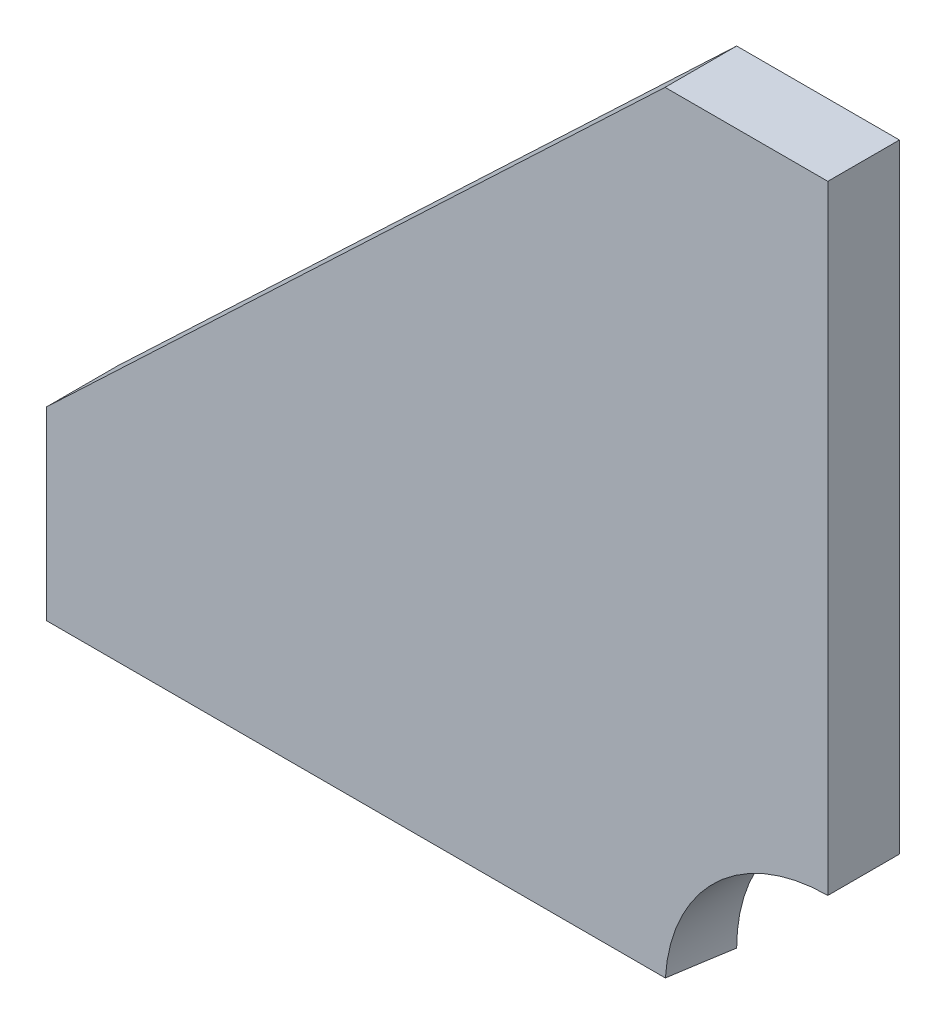
from build123d import *

# Parameters (mm, degrees)
BOSS_EXTRUDE1_DEPTH = 11
CUT_EXTRUDE1_DEPTH  = 116


with BuildPart() as part:
    # Sketch1 → Boss-Extrude1 (new body)
    with BuildSketch(Plane.XY):
        with BuildLine():
            Line((25, 0), (0, 0))
            Line((0, 0), (-95, -90))
            Line((-95, -90), (-95, -120))
            Line((-95, -120), (0, -120))
            ThreePointArc((0, -120), (7.32233047, -102.32233047), (25, -95))
            Line((25, -95), (25, 0))
        make_face()
    extrude(amount=BOSS_EXTRUDE1_DEPTH)

    # Sketch2 → Cut-Extrude1 (cut)
    with BuildSketch(Plane.ZY.offset(95)):
        Polygon((0, -120), (11, -120), (11, -118.454050818), align=None)
    extrude(amount=-CUT_EXTRUDE1_DEPTH, mode=Mode.SUBTRACT)


solid = part.part
